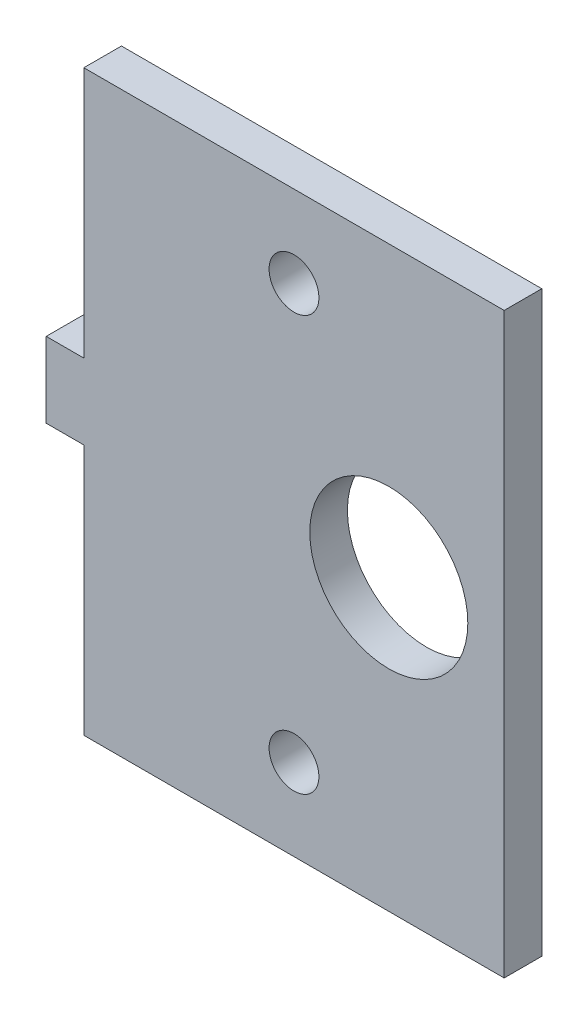
from build123d import *

# Parameters (mm, degrees)
SKETCH1_W           = 35.47213452
SKETCH1_H           = 48.789667988
BOSS_EXTRUDE1_DEPTH = 3.175
SKETCH2_R           = 2.10185
SKETCH2_R_2         = 6.6675
CUT_EXTRUDE1_DEPTH  = 31.327489716
BOSS_EXTRUDE2_DEPTH = 3.175


with BuildPart() as part:
    # Sketch1 → Boss-Extrude1 (new body)
    with BuildSketch(Plane.XY):
        Rectangle(SKETCH1_W, SKETCH1_H)
    extrude(amount=BOSS_EXTRUDE1_DEPTH)

    # Sketch2 → Cut-Extrude1 (cut, through all)
    with BuildSketch(Plane(origin=(0, 0, 0), x_dir=(-1, 0, 0), z_dir=(0, 0, -1))):
        with Locations((0, 17.5)):
            Circle(SKETCH2_R)
        with Locations((0, -17.5)):
            Circle(SKETCH2_R)
        with Locations((-8, 0)):
            Circle(SKETCH2_R_2)
    extrude(amount=-CUT_EXTRUDE1_DEPTH, mode=Mode.SUBTRACT)

    # Sketch3 → Boss-Extrude2 (add)
    with BuildSketch(Plane.ZY.offset(17.73606726)):
        Polygon((0, 0), (0, -3.175), (3.175, -3.175), (3.175, 3.175), (0, 3.175), align=None)
    extrude(amount=BOSS_EXTRUDE2_DEPTH)


solid = part.part
